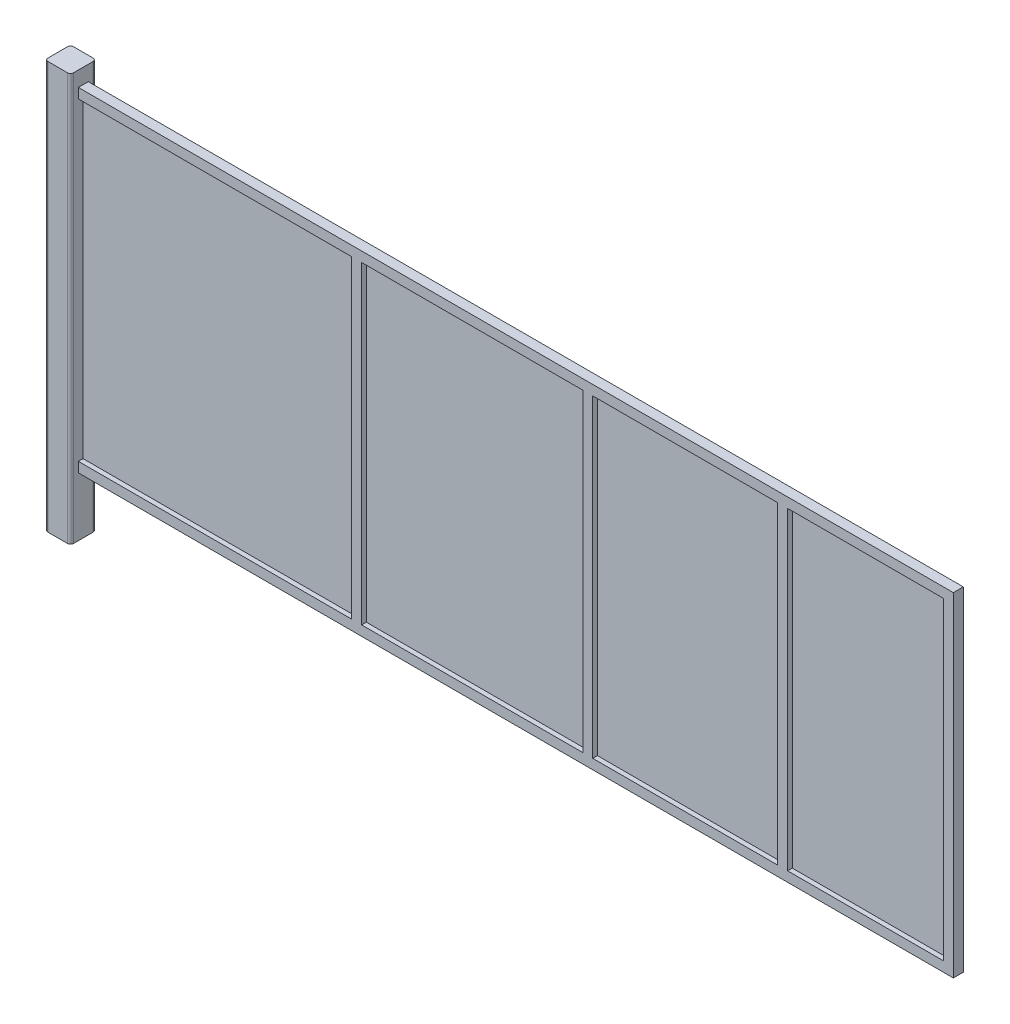
from build123d import *

# Parameters (mm, degrees)
SALIENTE_EXTRUIR1_DEPTH      = 1435
SALIENTE_EXTRUIR2_DEPTH      = 17.5
SALIENTE_EXTRUIR2_DEPTH_BACK = 17.5
CROQUIS2_W                   = 548.37236968
CROQUIS2_H                   = 1104.83636681
CROQUIS2_W_2                 = 778.490117554
CROQUIS2_W_3                 = 650.883824605
CROQUIS3_W                   = 962.253688161
CROQUIS3_H                   = 1104.83636681
CROQUIS3_W_2                 = 778.490117554
CROQUIS3_W_3                 = 650.883824605
CROQUIS3_W_4                 = 548.37236968
SALIENTE_EXTRUIR3_DEPTH      = 1


with BuildPart() as part:
    # Croquis1 → Saliente-Extruir1 (new body)
    with BuildSketch(Plane(origin=(0, 0, 0), x_dir=(1, 0, 0), z_dir=(0, 1, 0))):
        with BuildLine():
            Line((-34.389023271, 45), (34.389023271, 45))
            ThreePointArc((34.389023271, 45), (41.892116871, 41.892116871), (45, 34.389023271))
            Line((45, 34.389023271), (45, -34.389023271))
            ThreePointArc((45, -34.389023271), (41.892116871, -41.892116871), (34.389023271, -45))
            Line((34.389023271, -45), (-34.389023271, -45))
            ThreePointArc((-34.389023271, -45), (-41.892116871, -41.892116871), (-45, -34.389023271))
            Line((-45, -34.389023271), (-45, 34.389023271))
            ThreePointArc((-45, 34.389023271), (-41.892116871, 41.892116871), (-34.389023271, 45))
        make_face()
    extrude(amount=SALIENTE_EXTRUIR1_DEPTH)

    # Croquis2 → Saliente-Extruir2 (add, two sides: drawn at the far end of the back side and taken through both)
    with BuildSketch(Plane.XY.offset(-SALIENTE_EXTRUIR2_DEPTH_BACK)):
        Polygon((45, 1381.912908734), (3125, 1381.912908734), (3125, 207.076541924), (45, 207.076541924), (45, 242.076541924), (1007.253688161, 242.076541924), (1007.253688161, 1346.912908734), (45, 1346.912908734), align=None)
        with Locations((2815.81381516, 794.494725329)):
            Rectangle(CROQUIS2_W, CROQUIS2_H, mode=Mode.SUBTRACT)
        with Locations((1431.498746938, 794.494725329)):
            Rectangle(CROQUIS2_W_2, CROQUIS2_H, mode=Mode.SUBTRACT)
        with Locations((2181.185718018, 794.494725329)):
            Rectangle(CROQUIS2_W_3, CROQUIS2_H, mode=Mode.SUBTRACT)
    extrude(amount=SALIENTE_EXTRUIR2_DEPTH + SALIENTE_EXTRUIR2_DEPTH_BACK)

    # Croquis3 → Saliente-Extruir3 (add)
    with BuildSketch(Plane.XY):
        with Locations((526.12684408, 794.494725329)):
            Rectangle(CROQUIS3_W, CROQUIS3_H)
        with Locations((1431.498746938, 794.494725329)):
            Rectangle(CROQUIS3_W_2, CROQUIS3_H)
        with Locations((2181.185718018, 794.494725329)):
            Rectangle(CROQUIS3_W_3, CROQUIS3_H)
        with Locations((2815.81381516, 794.494725329)):
            Rectangle(CROQUIS3_W_4, CROQUIS3_H)
    extrude(amount=SALIENTE_EXTRUIR3_DEPTH)


solid = part.part
